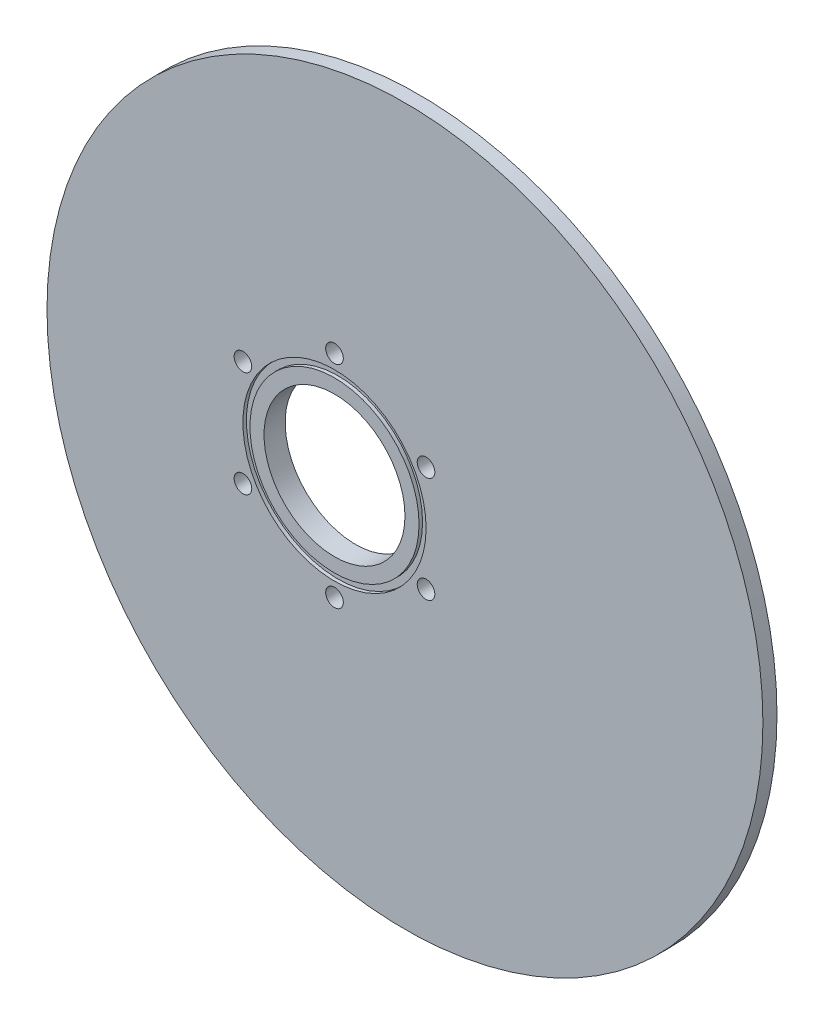
from build123d import *

# Parameters (mm, degrees)
SKETCH3_R          = 20
CUT_EXTRUDE1_DEPTH = 144.809318196
SKETCH4_R          = 2.5
CUT_EXTRUDE3_DEPTH = 144.809318196
SKETCH5_R          = 26
SKETCH5_R_2        = 24
CUT_EXTRUDE4_DEPTH = 1


with BuildPart() as part:
    # Sketch2 → Revolve1 (revolve)
    with BuildSketch(Plane(origin=(0, 0, 0), x_dir=(0, 0, -1), z_dir=(1, 0, 0)), mode=Mode.PRIVATE) as revolve1_sk:
        Polygon((0, 0), (0, 101.6), (4, 101.6), (4, 95.25), (6, 95.25), (6, 0), align=None)
    revolve(revolve1_sk.sketch.rotate(Axis((0, 0, -6), (0, 0, 1)), 90), axis=Axis((0, 0, -6), (0, 0, 1)))

    # Sketch3 → Cut-Extrude1 (cut, through all)
    with BuildSketch(Plane.XY):
        with Locations((-20, 0)):
            Circle(SKETCH3_R)
    extrude(amount=-CUT_EXTRUDE1_DEPTH, mode=Mode.SUBTRACT)

    # Sketch4 → Cut-Extrude3 (cut, through all)
    with BuildSketch(Plane.XY):
        with Locations((-20, 30)):
            Circle(SKETCH4_R)
        with Locations((5.980762114, 15)):
            Circle(SKETCH4_R)
        with Locations((5.980762114, -15)):
            Circle(SKETCH4_R)
        with Locations((-20, -30)):
            Circle(SKETCH4_R)
        with Locations((-45.980762114, -15)):
            Circle(SKETCH4_R)
        with Locations((-45.980762114, 15)):
            Circle(SKETCH4_R)
    extrude(amount=-CUT_EXTRUDE3_DEPTH, mode=Mode.SUBTRACT)

    # Sketch5 → Cut-Extrude4 (cut)
    with BuildSketch(Plane.XY):
        with Locations((-20, 0)):
            Circle(SKETCH5_R)
        with Locations((-20, 0)):
            Circle(SKETCH5_R_2, mode=Mode.SUBTRACT)
    extrude(amount=-CUT_EXTRUDE4_DEPTH, mode=Mode.SUBTRACT)


solid = part.part
